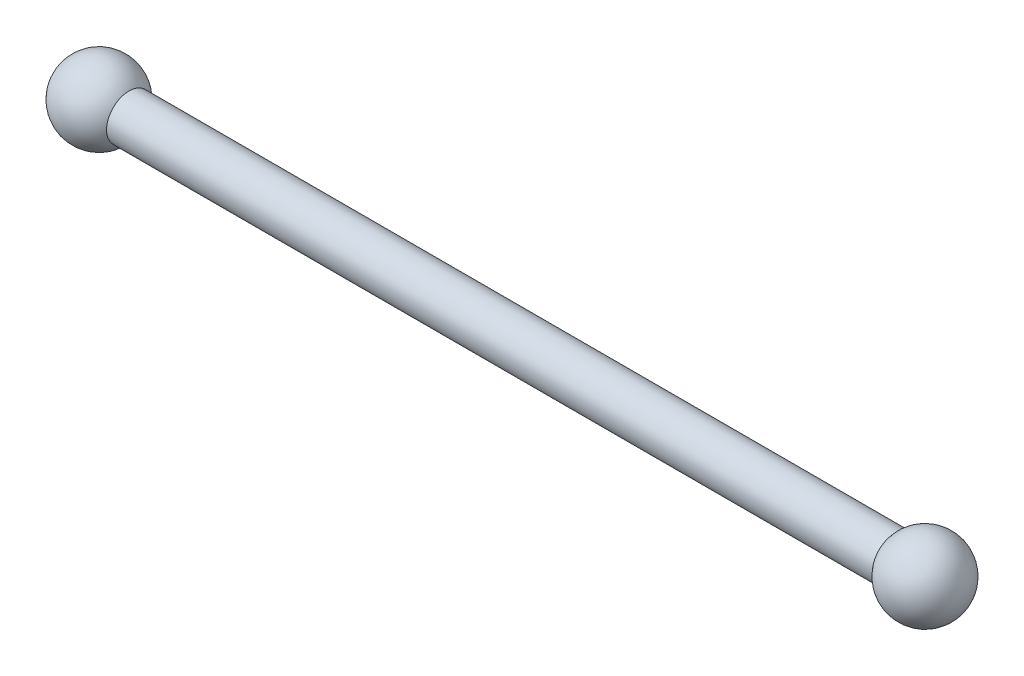
from build123d import *

# Parameters (mm, degrees)
SKETCH5_R   = 1.5
SHAFT_DEPTH = 55


with BuildPart() as part:
    # Sketch4 → Semi-circle Revolve (revolve)
    with BuildSketch(Plane(origin=(0, 0, 0), x_dir=(0, 0, -1), z_dir=(1, 0, 0))):
        with BuildLine():
            Line((0, 0), (2.5, 0))
            Line((2.5, 0), (2.5, -2.5))
            ThreePointArc((2.5, -2.5), (0.732233047, -1.767766953), (0, 0))
        make_face()
    semi_circle_revolve = revolve(axis=Axis((0, 0, -2.5), (0, -1, 0)))

    # Full-circle Mirror: Semi-circle Revolve across plane
    add(semi_circle_revolve.mirror(Plane(origin=(0, 0, 0), x_dir=(0, 0, 1), z_dir=(0, -1, 0))))

    # Sketch5 → Shaft (add)
    with BuildSketch(Plane(origin=(0, 0, 0), x_dir=(0, 0, -1), z_dir=(1, 0, 0))):
        with Locations(Location((2.5, 0, 0), (0, 0, 180))):
            Circle(SKETCH5_R)
    extrude(amount=SHAFT_DEPTH)

    # Sketch6 → Opposite Semi-circle Revolve (revolve)
    with BuildSketch(Plane(origin=(55, 0, 0), x_dir=(0, 0, -1), z_dir=(1, 0, 0))):
        with BuildLine():
            Line((0, 0), (2.5, 0))
            Line((2.5, 0), (2.5, -2.5))
            ThreePointArc((2.5, -2.5), (0.732233047, -1.767766953), (0, 0))
        make_face()
    opposite_semi_circle_revolve = revolve(axis=Axis((55, 0, -2.5), (0, -1, 0)))

    # Opposite Full-circle Mirror: Opposite Semi-circle Revolve across plane
    add(opposite_semi_circle_revolve.mirror(Plane(origin=(55, 0, 0), x_dir=(0, 0, 1), z_dir=(0, 1, 0))))


solid = part.part
